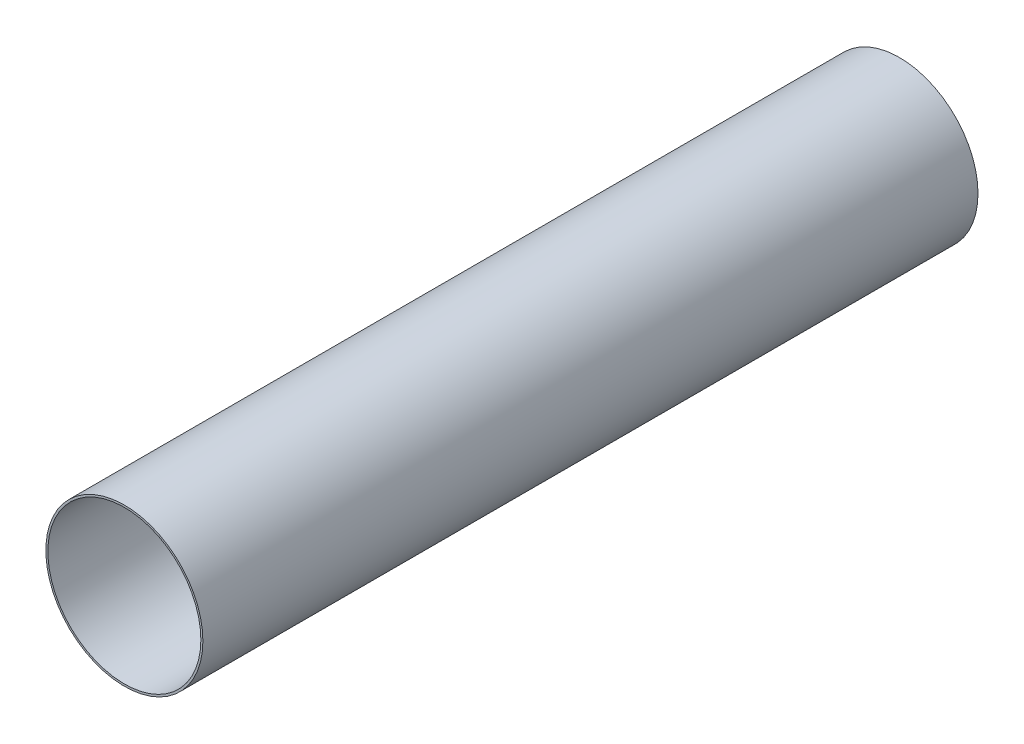
from build123d import *

# Parameters (mm, degrees)
SKETCH1_R           = 78
SKETCH1_R_2         = 76
BOSS_EXTRUDE1_DEPTH = 770


with BuildPart() as part:
    # Sketch1 → Boss-Extrude1 (new body)
    with BuildSketch(Plane.XY):
        Circle(SKETCH1_R)
        Circle(SKETCH1_R_2, mode=Mode.SUBTRACT)
    extrude(amount=BOSS_EXTRUDE1_DEPTH)


solid = part.part
